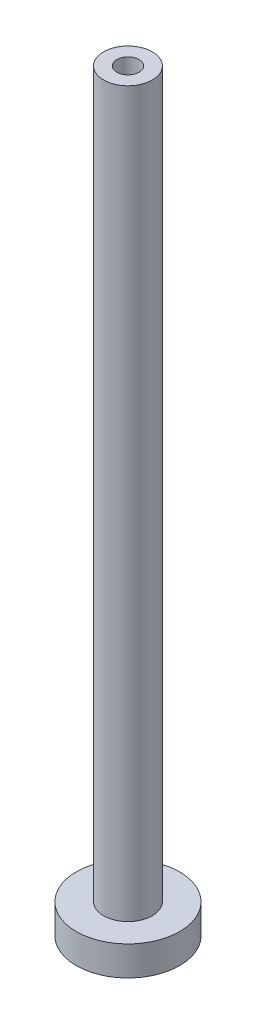
from build123d import *

# Parameters (mm, degrees)
SKETCH1_R           = 7
BOSS_EXTRUDE1_DEPTH = 4
SKETCH2_R           = 3.3
BOSS_EXTRUDE2_DEPTH = 86
SKETCH3_R           = 3.3
BOSS_EXTRUDE3_DEPTH = 12
SKETCH4_R           = 1.5
CUT_EXTRUDE2_DEPTH  = 103.479266196


with BuildPart() as part:
    # Sketch1 → Boss-Extrude1 (new body)
    with BuildSketch(Plane(origin=(0, 0, 0), x_dir=(1, 0, 0), z_dir=(0, 1, 0))):
        with Locations(Location((0, 0, 0), (0, 0, 270))):
            Circle(SKETCH1_R)
    extrude(amount=BOSS_EXTRUDE1_DEPTH)

    # Sketch2 → Boss-Extrude2 (add)
    with BuildSketch(Plane(origin=(0, 4, 0), x_dir=(1, 0, 0), z_dir=(0, 1, 0))):
        with Locations(Location((0, 0, 0), (0, 0, 270))):
            Circle(SKETCH2_R)
    extrude(amount=BOSS_EXTRUDE2_DEPTH)

    # Sketch3 → Boss-Extrude3 (add)
    with BuildSketch(Plane(origin=(0, 90, 0), x_dir=(1, 0, 0), z_dir=(0, 1, 0))):
        with Locations(Location((0, 0, 0), (0, 0, 270))):
            Circle(SKETCH3_R)
    extrude(amount=BOSS_EXTRUDE3_DEPTH)

    # Sketch4 → Cut-Extrude2 (cut, through all)
    with BuildSketch(Plane(origin=(0, 102, 0), x_dir=(1, 0, 0), z_dir=(0, 1, 0))):
        with Locations(Location((0, 0, 0), (0, 0, 270))):
            Circle(SKETCH4_R)
    extrude(amount=-CUT_EXTRUDE2_DEPTH, mode=Mode.SUBTRACT)


solid = part.part
